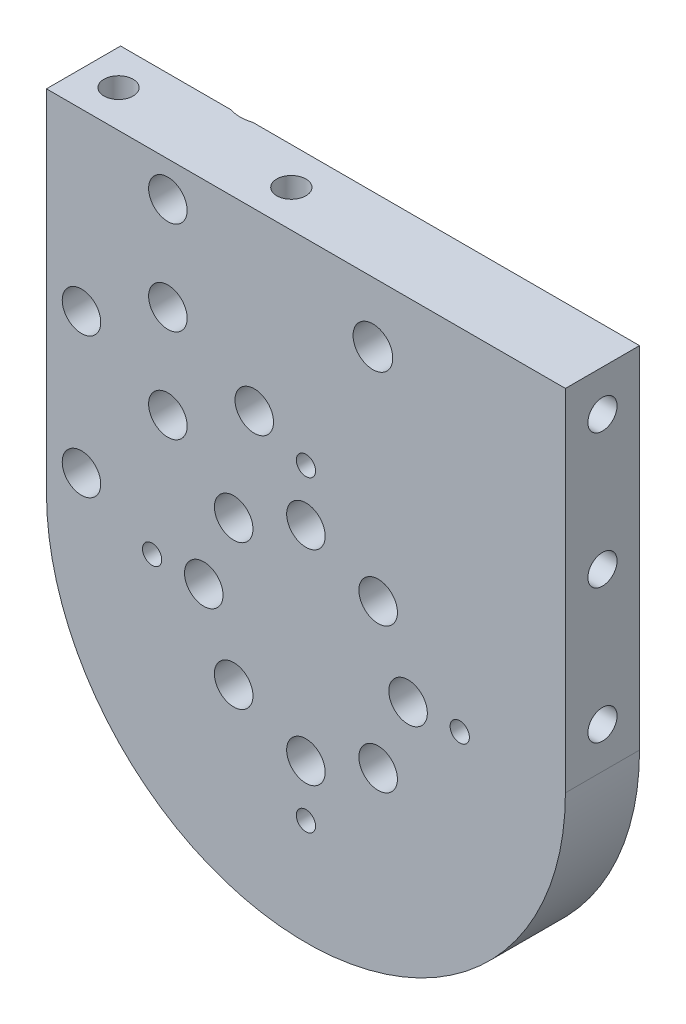
from build123d import *

# Parameters (mm, degrees)
BOSS_EXTRUDE1_DEPTH                                 = 12.7
F_4_CLEARANCE_HOLE1_D                               = 3.3
F_1_4_CLEARANCE_HOLE1_D                             = 6.6
F_1_4_CLEARANCE_HOLE2_D                             = 6.8
CSK_FOR_1_4_FLAT_HEAD_MACHINE_SCREW_100_D           = 6.6
CSK_FOR_1_4_FLAT_HEAD_MACHINE_SCREW_100_CSINK_D     = 12.6
CSK_FOR_1_4_FLAT_HEAD_MACHINE_SCREW_100_CSINK_ANGLE = 90
F_10_CLEARANCE_HOLE1_D                              = 5
F_10_CLEARANCE_HOLE1_DEPTH                          = 15
F_10_CLEARANCE_HOLE2_D                              = 5
F_10_CLEARANCE_HOLE2_DEPTH                          = 10
F_1_3_4_CLEARANCE_HOLE1_D                           = 45
F_1_3_4_CLEARANCE_HOLE1_DEPTH                       = 5
F_1_4_CLEARANCE_HOLE3_D                             = 6.6
F_1_4_CLEARANCE_HOLE3_DEPTH                         = 12.7
CHAMFER1_SIZE                                       = 3


with BuildPart() as part:
    # Sketch1 → Boss-Extrude1 (new body)
    with BuildSketch(Plane(origin=(0, 0, 0), x_dir=(-1, 0, 0), z_dir=(0, 0, -1))):
        with BuildLine():
            Line((44.45, 0), (44.45, 60))
            Line((44.45, 60), (-44.45, 60))
            Line((-44.45, 60), (-44.45, 0))
            ThreePointArc((-44.45, 0), (0, -44.45), (44.45, 0))
        make_face()
    extrude(amount=-BOSS_EXTRUDE1_DEPTH)

    # #4 Clearance Hole1 (through all)
    with Locations(Plane.XY.offset(12.7)):
        with Locations((26.35, 0), (0, -26.35), (-26.35, 0), (0, 26.35)):
            Hole(F_4_CLEARANCE_HOLE1_D / 2)

    # 1/4 Clearance Hole1 (through all)
    with Locations(Plane(origin=(0, 0, 0), x_dir=(-1, 0, 0), z_dir=(0, 0, -1))):
        with Locations((8.85, 30), (23.65, 38), (23.65, 22)):
            Hole(F_1_4_CLEARANCE_HOLE1_D / 2)

    # 1/4 Clearance Hole2 (through all)
    with Locations(Plane.XY.offset(12.7)):
        with Locations((11.472503772, 49.692873304)):
            Hole(F_1_4_CLEARANCE_HOLE2_D / 2)

    # CSK for 1/4 Flat Head Machine Screw (100)1 (through all)
    with Locations(Plane(origin=(0, 0, 0), x_dir=(-1, 0, 0), z_dir=(0, 0, -1))):
        with Locations((23.65, 54), (38.45, 6), (38.45, 30)):
            CounterSinkHole(CSK_FOR_1_4_FLAT_HEAD_MACHINE_SCREW_100_D / 2, CSK_FOR_1_4_FLAT_HEAD_MACHINE_SCREW_100_CSINK_D / 2, counter_sink_angle=CSK_FOR_1_4_FLAT_HEAD_MACHINE_SCREW_100_CSINK_ANGLE)

    # #10 Clearance Hole1
    with Locations(Plane(origin=(0, 60, 0), x_dir=(1, 0, 0), z_dir=(0, 1, 0))):
        with Locations((-38.45, -6.35), (-8.85, -6.35)):
            Hole(F_10_CLEARANCE_HOLE1_D / 2, depth=F_10_CLEARANCE_HOLE1_DEPTH)

    # #10 Clearance Hole2
    with Locations(Plane(origin=(44.45, 0, 0), x_dir=(0, 0, -1), z_dir=(1, 0, 0))):
        with Locations((-6.35, 7), (-6.35, 53), (-6.35, 30)):
            Hole(F_10_CLEARANCE_HOLE2_D / 2, depth=F_10_CLEARANCE_HOLE2_DEPTH)

    # 1-3/4 Clearance Hole1
    with Locations(Plane(origin=(0, 0, 0), x_dir=(-1, 0, 0), z_dir=(0, 0, -1))):
        with Locations((0, 0)):
            Hole(F_1_3_4_CLEARANCE_HOLE1_D / 2, depth=F_1_3_4_CLEARANCE_HOLE1_DEPTH)

    # 1/4 Clearance Hole3
    with Locations(Plane.XY.offset(12.7)):
        with Locations((12.374075778, 12.373661564), (17.499, -0.001), (12.372661564, -12.375075778), (-0.002, -17.5), (-12.376075778, -12.373661564), (-17.501, 0.001), (-12.374661564, 12.375075778), (0, 17.5)):
            Hole(F_1_4_CLEARANCE_HOLE3_D / 2, depth=F_1_4_CLEARANCE_HOLE3_DEPTH)

    # Chamfer1
    chamfer1_edges = [part.edges().sort_by_distance(p)[0] for p in [
        (-26.95, 22, 0),
        (-26.95, 38, 0),
        (-12.15, 30, 0),
    ]]
    chamfer(chamfer1_edges, length=CHAMFER1_SIZE)


solid = part.part
